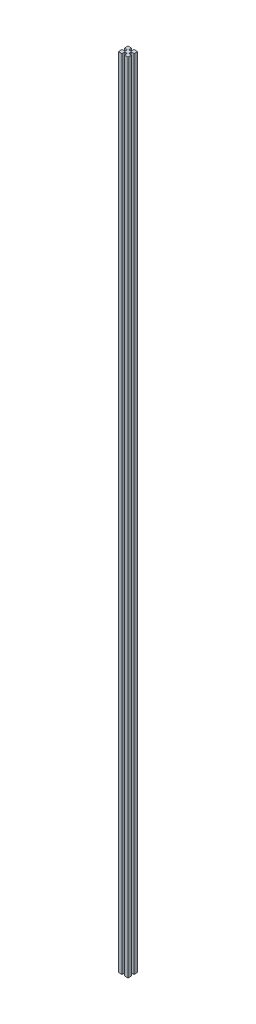
from build123d import *

# Parameters (mm, degrees)
BOSS_EXTRUDE1_DEPTH      = 825.5
BOSS_EXTRUDE1_DEPTH_BACK = 825.5
SKETCH1_W                = 20
SKETCH1_H                = 20
CUT_EXTRUDE1_DEPTH       = 826.621129817
CUT_EXTRUDE1_DEPTH_BACK  = 826.621129817
SKETCH2_W                = 5
SKETCH2_H                = 12
SKETCH2_W_2              = 12
SKETCH2_H_2              = 5


with BuildPart() as part:
    # Sketch1 → Boss-Extrude1 (new, two sides: drawn at the far end of the back side and taken through both)
    with BuildSketch(Plane(origin=(0, 0, 0), x_dir=(1, 0, 0), z_dir=(0, 1, 0)).offset(-BOSS_EXTRUDE1_DEPTH_BACK)):
        Rectangle(SKETCH1_W, SKETCH1_H)
    extrude(amount=BOSS_EXTRUDE1_DEPTH + BOSS_EXTRUDE1_DEPTH_BACK)

    # Sketch2 → Cut-Extrude1 (cut, two sides: drawn at the far end of the back side and taken through both)
    with BuildSketch(Plane(origin=(0, 0, 0), x_dir=(1, 0, 0), z_dir=(0, 1, 0)).offset(-CUT_EXTRUDE1_DEPTH_BACK)):
        with Locations((0, 10)):
            Rectangle(SKETCH2_W, SKETCH2_H)
        with Locations((10, 0)):
            Rectangle(SKETCH2_W_2, SKETCH2_H_2)
        with Locations((-10, 0)):
            Rectangle(SKETCH2_W_2, SKETCH2_H_2)
        with Locations((0, -10)):
            Rectangle(SKETCH2_W, SKETCH2_H)
    extrude(amount=CUT_EXTRUDE1_DEPTH + CUT_EXTRUDE1_DEPTH_BACK, mode=Mode.SUBTRACT)


solid = part.part
